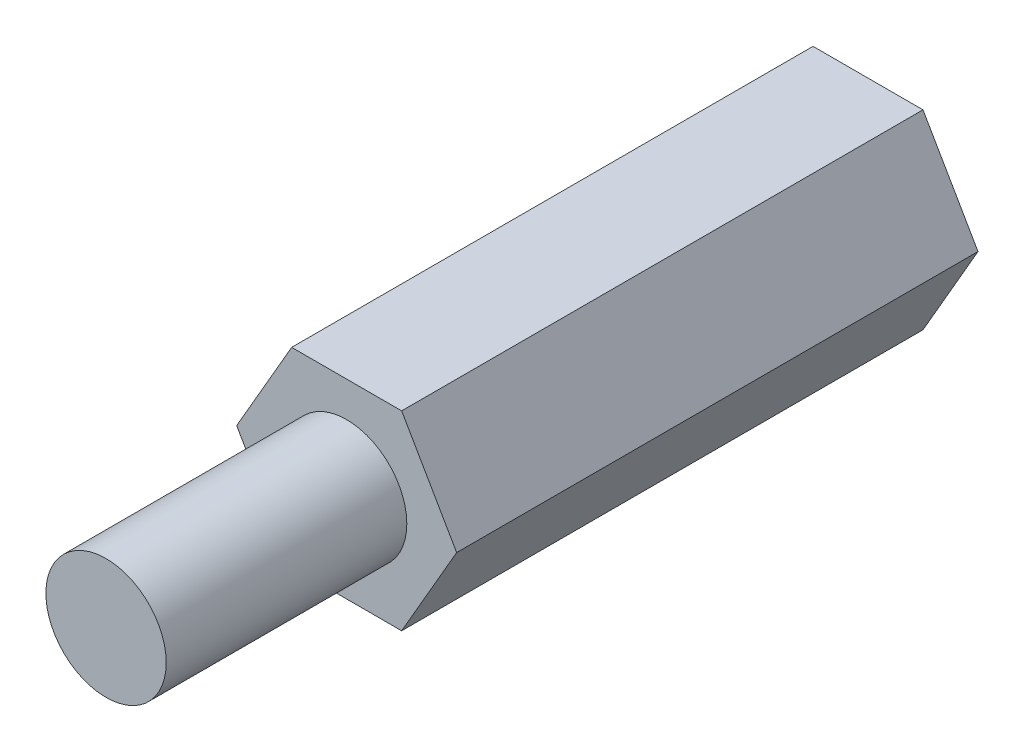
from build123d import *

# Parameters (mm, degrees)
EXTRUDE_2_DEPTH = 13
SKETCH_10_R     = 1.5
EXTRUDE_3_DEPTH = 6


with BuildPart() as part:
    # 草图9 → 凸台-拉伸2 (new body)
    with BuildSketch(Plane.XY):
        Polygon((2.742413779, 0), (1.371206889, 2.375), (-1.371206889, 2.375), (-2.742413779, 0), (-1.371206889, -2.375), (1.371206889, -2.375), align=None)
    extrude(amount=EXTRUDE_2_DEPTH)

    # 草图10 → 凸台-拉伸3 (add)
    with BuildSketch(Plane.XY.offset(13)):
        Circle(SKETCH_10_R)
    extrude(amount=EXTRUDE_3_DEPTH)


solid = part.part
